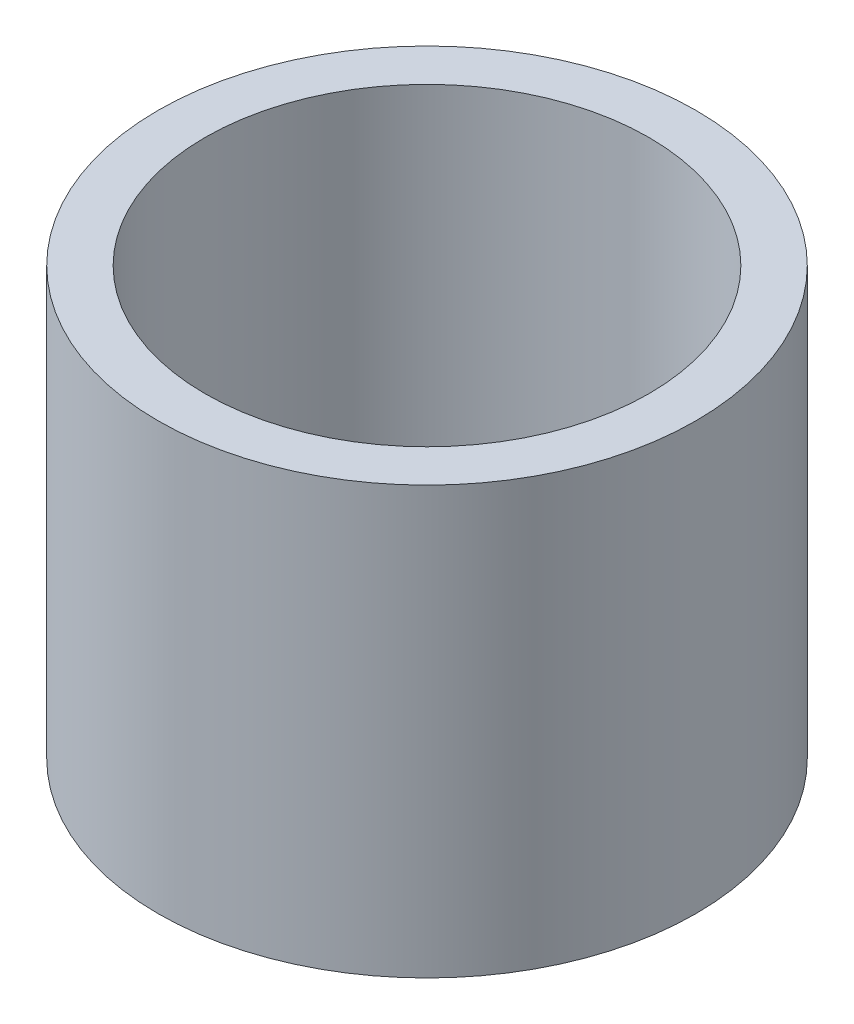
from build123d import *

# Parameters (mm, degrees)
SKETCH_1_R      = 12.6
EXTRUDE_1_DEPTH = 20
SHELL_1_T       = -2.2


with BuildPart() as part:
    # 스케치1 → 보스-돌출1 (new body)
    with BuildSketch(Plane(origin=(0, 0, 0), x_dir=(1, 0, 0), z_dir=(0, 1, 0))):
        with Locations(Location((0, 0, 0), (0, 0, 270))):
            Circle(SKETCH_1_R)
    extrude(amount=EXTRUDE_1_DEPTH)

    # 쉘1
    shell_1_openings = [part.faces().sort_by_distance(p)[0] for p in [
        (0, 20, 0),
        (0, 0, 0),
    ]]
    offset(amount=SHELL_1_T, openings=shell_1_openings, kind=Kind.INTERSECTION)


solid = part.part
